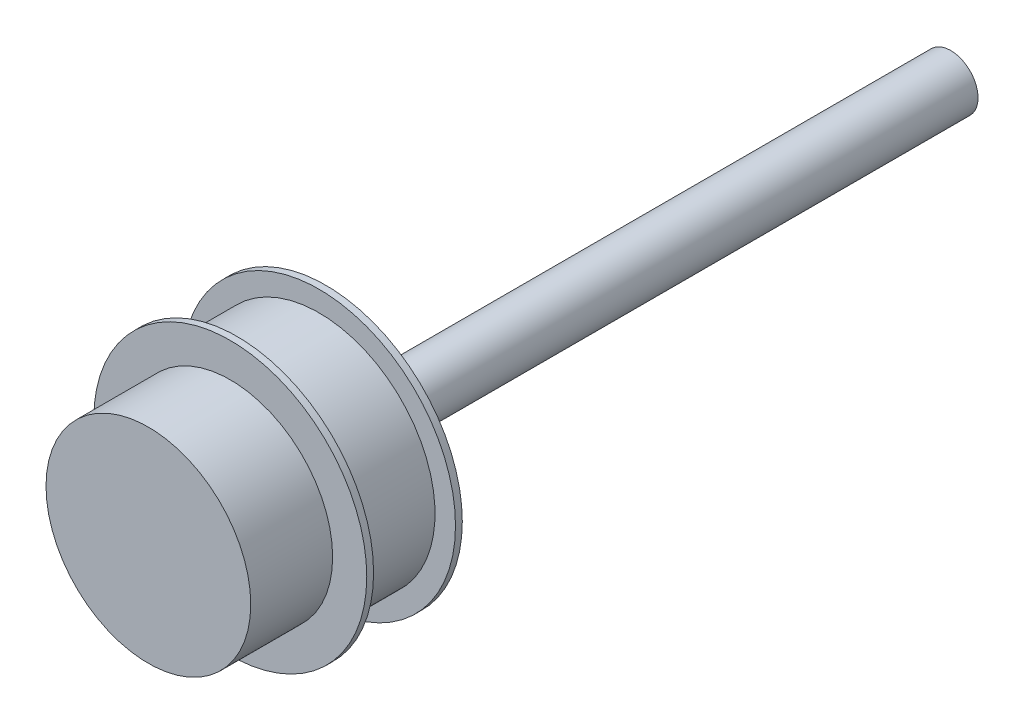
from build123d import *

# Parameters (mm, degrees)
SKETCH_1_R          = 4
EXTRUDE_1_DEPTH     = 91.56
SKETCH_2_R          = 20
EXTRUDE_2_DEPTH     = 14
SKETCH_3_R          = 15
EXTRUDE_3_DEPTH     = 12
SKETCH_4_R          = 20
SKETCH_4_R_2        = 17
CUT_EXTRUDE_1_DEPTH = 13
SKETCH_5_R          = 20
EXTRUDE_4_DEPTH     = 1


with BuildPart() as part:
    # 草图1 → 凸台-拉伸1 (new body)
    with BuildSketch(Plane.XY):
        Circle(SKETCH_1_R)
    extrude(amount=EXTRUDE_1_DEPTH)

    # 草图2 → 凸台-拉伸2 (add)
    with BuildSketch(Plane.XY.offset(91.56)):
        Circle(SKETCH_2_R)
    extrude(amount=EXTRUDE_2_DEPTH)

    # 草图3 → 凸台-拉伸3 (add)
    with BuildSketch(Plane.XY.offset(105.56)):
        Circle(SKETCH_3_R)
    extrude(amount=EXTRUDE_3_DEPTH)

    # 草图4 → 切除-拉伸1 (cut)
    with BuildSketch(Plane(origin=(0, 0, 91.56), x_dir=(-1, 0, 0), z_dir=(0, 0, -1))):
        Circle(SKETCH_4_R)
        Circle(SKETCH_4_R_2, mode=Mode.SUBTRACT)
    extrude(amount=-CUT_EXTRUDE_1_DEPTH, mode=Mode.SUBTRACT)

    # 草图5 → 凸台-拉伸4 (add)
    with BuildSketch(Plane(origin=(0, 0, 91.56), x_dir=(-1, 0, 0), z_dir=(0, 0, -1))):
        Circle(SKETCH_5_R)
    extrude(amount=-EXTRUDE_4_DEPTH)


solid = part.part
